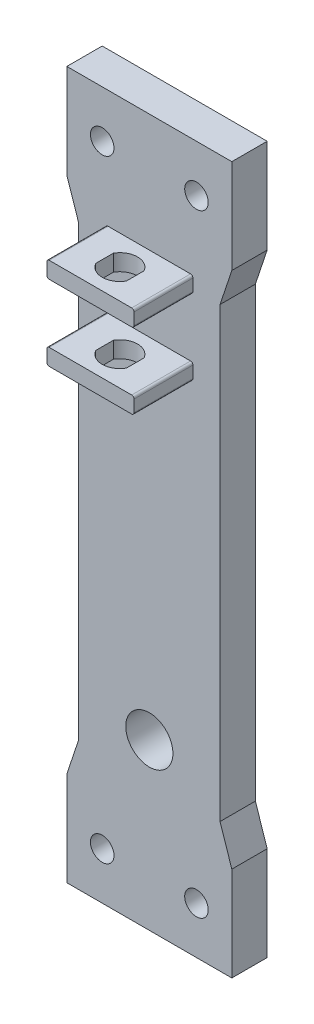
from build123d import *

# Parameters (mm, degrees)
BOSS_EXTRUDE1_DEPTH = 15
SKETCH1_3_R         = 5
SKETCH1_3_R_2       = 10
CUT_EXTRUDE1_DEPTH  = 15
BOSS_EXTRUDE2_DEPTH = 25
CUT_EXTRUDE3_DEPTH  = 254.673017879


with BuildPart() as part:
    # Sketch1 → Boss-Extrude1 (new body)
    with BuildSketch(Plane.XY):
        Polygon((-35, 150), (35, 150), (35, 110), (30, 95), (30, -95), (35, -110), (35, -150), (-35, -150), (-35, -110), (-30, -95), (-30, 95), (-35, 110), align=None)
    extrude(amount=-BOSS_EXTRUDE1_DEPTH)

    # Sketch1<3> → Cut-Extrude1 (cut)
    with BuildSketch(Plane.XY):
        with Locations((-20, 130)):
            Circle(SKETCH1_3_R)
        with Locations((20, 130)):
            Circle(SKETCH1_3_R)
        with Locations((0, -80)):
            Circle(SKETCH1_3_R_2)
        with Locations((20, -130)):
            Circle(SKETCH1_3_R)
        with Locations((-20, -130)):
            Circle(SKETCH1_3_R)
    extrude(amount=-CUT_EXTRUDE1_DEPTH, mode=Mode.SUBTRACT)

    # Sketch1<4> → Boss-Extrude2 (add)
    with BuildSketch(Plane.XY):
        with BuildLine():
            Line((-17.5, 100), (17.5, 100))
            ThreePointArc((17.5, 100), (18.207106781, 99.707106781), (18.5, 99))
            Line((18.5, 99), (18.5, 94))
            ThreePointArc((18.5, 94), (18.207106781, 93.292893219), (17.5, 93))
            Line((17.5, 93), (-17.5, 93))
            ThreePointArc((-17.5, 93), (-18.207106781, 93.292893219), (-18.5, 94))
            Line((-18.5, 94), (-18.5, 99))
            ThreePointArc((-18.5, 99), (-18.207106781, 99.707106781), (-17.5, 100))
        make_face()
        with BuildLine():
            Line((-17.5, 68), (17.5, 68))
            ThreePointArc((17.5, 68), (18.207106781, 67.707106781), (18.5, 67))
            Line((18.5, 67), (18.5, 62))
            ThreePointArc((18.5, 62), (18.207106781, 61.292893219), (17.5, 61))
            Line((17.5, 61), (-17.5, 61))
            ThreePointArc((-17.5, 61), (-18.207106781, 61.292893219), (-18.5, 62))
            Line((-18.5, 62), (-18.5, 67))
            ThreePointArc((-18.5, 67), (-18.207106781, 67.707106781), (-17.5, 68))
        make_face()
    extrude(amount=BOSS_EXTRUDE2_DEPTH)

    # Sketch2 → Cut-Extrude3 (cut, through all)
    with BuildSketch(Plane(origin=(0, 100, 0), x_dir=(1, 0, 0), z_dir=(0, 1, 0))):
        with BuildLine():
            Line((-6.5, -8.758342613), (-6.5, -16.241657387))
            ThreePointArc((-6.5, -16.241657387), (0, -20), (6.5, -16.241657387))
            Line((6.5, -16.241657387), (6.5, -8.758342613))
            ThreePointArc((6.5, -8.758342613), (0, -5), (-6.5, -8.758342613))
        make_face()
    extrude(amount=-CUT_EXTRUDE3_DEPTH, mode=Mode.SUBTRACT)


solid = part.part
